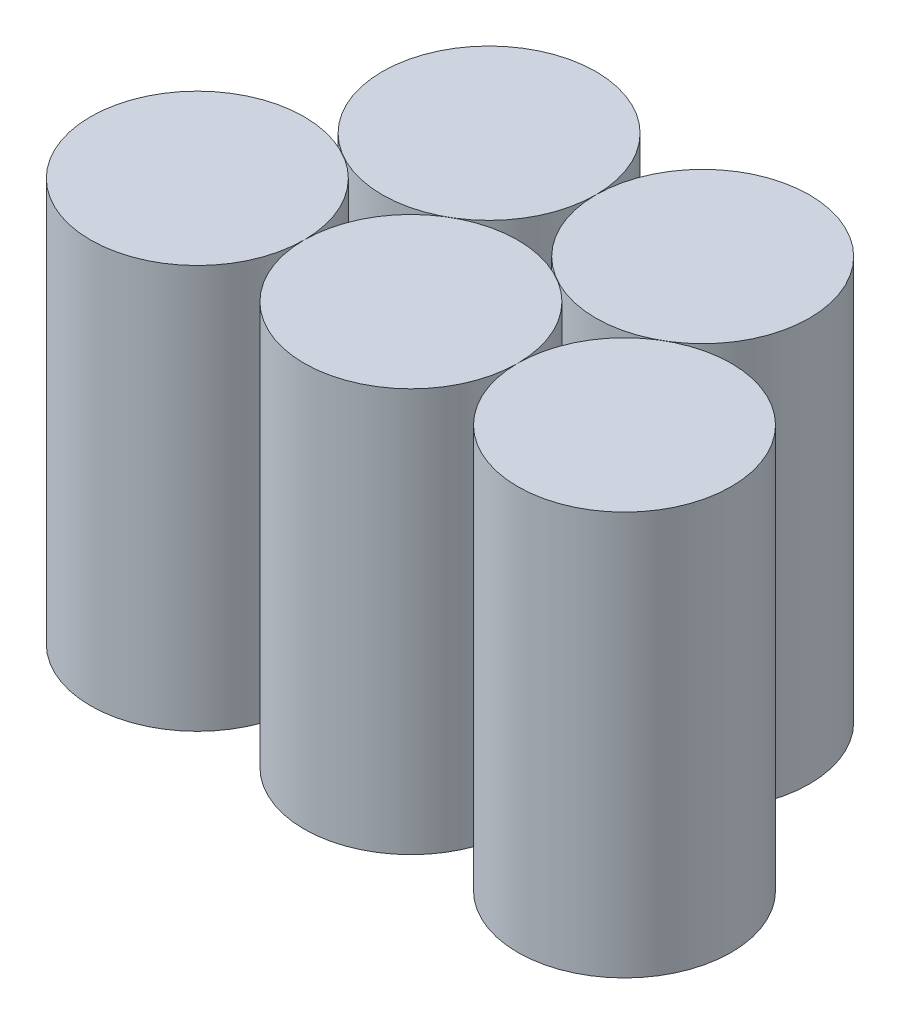
from build123d import *

# Parameters (mm, degrees)
SKETCH1_R             = 11.43
BOSS_EXTRUDE1_DEPTH   = 43.18
BOSS_EXTRUDE1_2_DEPTH = 43.18
BOSS_EXTRUDE1_3_DEPTH = 43.18
BOSS_EXTRUDE1_4_DEPTH = 43.18
BOSS_EXTRUDE1_5_DEPTH = 43.18


with BuildPart() as part:
    # Sketch1 → Boss-Extrude1 (new body)
    with BuildSketch(Plane(origin=(0, 0, 0), x_dir=(1, 0, 0), z_dir=(0, 1, 0))):
        with Locations(Location((-22.86, -11.43, 0), (0, 0, 270))):
            Circle(SKETCH1_R)
    extrude(amount=BOSS_EXTRUDE1_DEPTH)


with BuildPart() as body_2:
    # Sketch1 → Boss-Extrude1 2 (new body)
    with BuildSketch(Plane(origin=(0, 0, 0), x_dir=(1, 0, 0), z_dir=(0, 1, 0))):
        with Locations(Location((-11.43, 8.367340731, 0), (0, 0, 270))):
            Circle(SKETCH1_R)
    extrude(amount=BOSS_EXTRUDE1_2_DEPTH)


with BuildPart() as body_3:
    # Sketch1 → Boss-Extrude1 3 (new body)
    with BuildSketch(Plane(origin=(0, 0, 0), x_dir=(1, 0, 0), z_dir=(0, 1, 0))):
        with Locations(Location((0, -11.43, 0), (0, 0, 270))):
            Circle(SKETCH1_R)
    extrude(amount=BOSS_EXTRUDE1_3_DEPTH)


with BuildPart() as body_4:
    # Sketch1 → Boss-Extrude1 4 (new body)
    with BuildSketch(Plane(origin=(0, 0, 0), x_dir=(1, 0, 0), z_dir=(0, 1, 0))):
        with Locations(Location((11.43, 8.367340731, 0), (0, 0, 270))):
            Circle(SKETCH1_R)
    extrude(amount=BOSS_EXTRUDE1_4_DEPTH)


with BuildPart() as body_5:
    # Sketch1 → Boss-Extrude1 5 (new body)
    with BuildSketch(Plane(origin=(0, 0, 0), x_dir=(1, 0, 0), z_dir=(0, 1, 0))):
        with Locations(Location((22.86, -11.43, 0), (0, 0, 270))):
            Circle(SKETCH1_R)
    extrude(amount=BOSS_EXTRUDE1_5_DEPTH)


solid = Compound([part.part, body_2.part, body_3.part, body_4.part, body_5.part])
